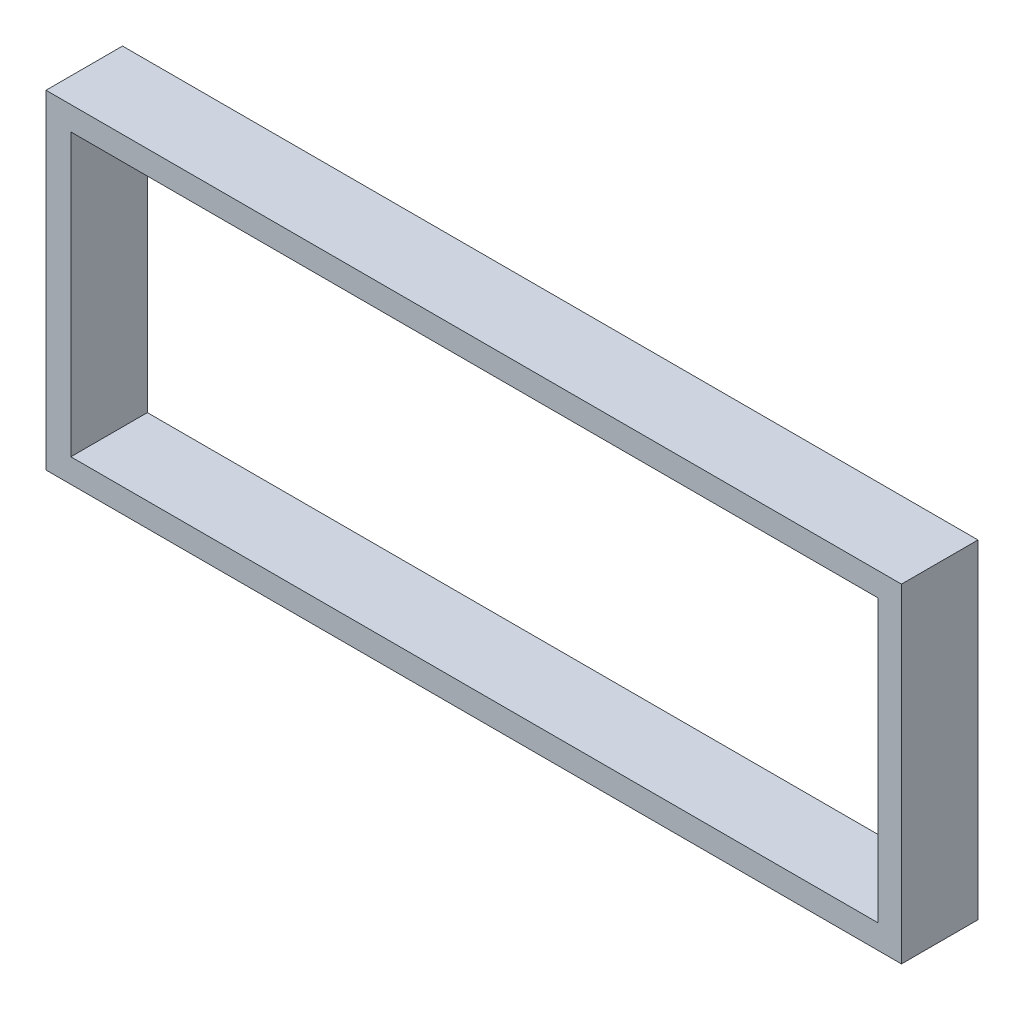
from build123d import *

# Parameters (mm, degrees)
SKETCH2_W           = 76.010410557
SKETCH2_H           = 29.226686217
SKETCH2_W_2         = 71.7
SKETCH2_H_2         = 25
BOSS_EXTRUDE1_DEPTH = 6.8


with BuildPart() as part:
    # Sketch2 → Boss-Extrude1 (new body)
    with BuildSketch(Plane.XY):
        with Locations((2.102639297, 11.354252199)):
            Rectangle(SKETCH2_W, SKETCH2_H)
        with Locations((2.155205279, 11.364956012)):
            Rectangle(SKETCH2_W_2, SKETCH2_H_2, mode=Mode.SUBTRACT)
    extrude(amount=BOSS_EXTRUDE1_DEPTH)


solid = part.part
